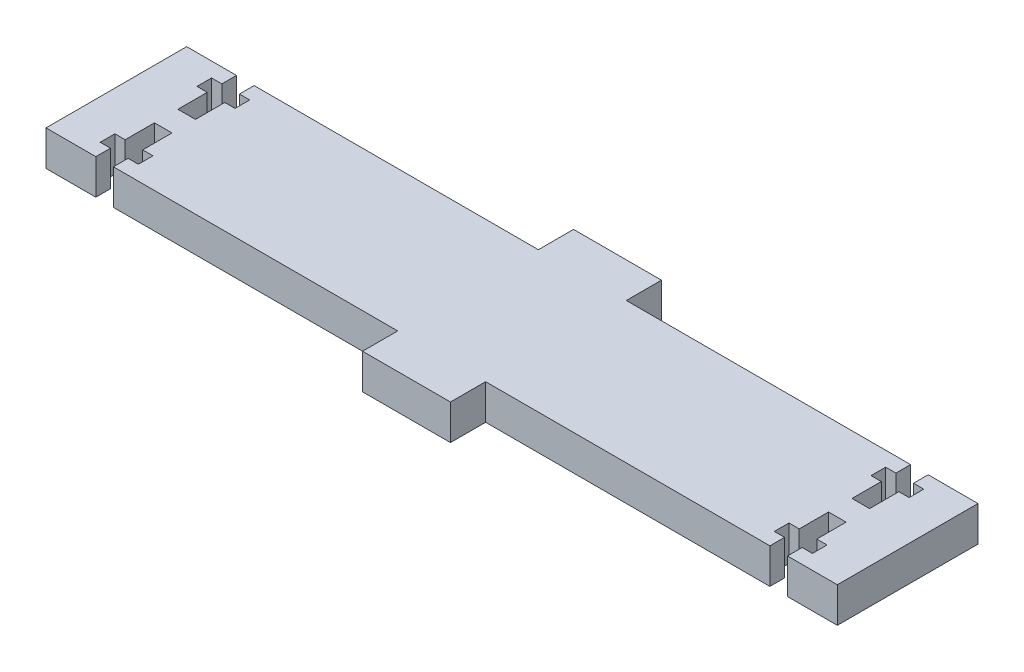
from build123d import *

# Parameters (mm, degrees)
BOSS_EXTRUDE1_DEPTH = 6


with BuildPart() as part:
    # Sketch1 → Boss-Extrude1 (new body)
    with BuildSketch(Plane(origin=(0, 0, 0), x_dir=(1, 0, 0), z_dir=(0, 1, 0))):
        Polygon((-59, 12), (-67.5, 12), (-67.5, -12), (-59, -12), (-59, -9.5), (-60.75, -9.5), (-60.75, -7), (-59, -7), (-59, -2), (-56, -2), (-56, -7), (-54.25, -7), (-54.25, -9.5), (-56, -9.5), (-56, -12), (-7.5, -12), (-7.5, -18), (7.5, -18), (7.5, -12), (56, -12), (56, -9.5), (54.25, -9.5), (54.25, -7), (56, -7), (56, -2), (59, -2), (59, -7), (60.75, -7), (60.75, -9.5), (59, -9.5), (59, -12), (67.5, -12), (67.5, 12), (59, 12), (59, 9.5), (60.75, 9.5), (60.75, 7), (59, 7), (59, 2), (56, 2), (56, 7), (54.25, 7), (54.25, 9.5), (56, 9.5), (56, 12), (7.5, 12), (7.5, 18), (-7.5, 18), (-7.5, 12), (-56, 12), (-56, 9.5), (-54.25, 9.5), (-54.25, 7), (-56, 7), (-56, 2), (-59, 2), (-59, 7), (-60.75, 7), (-60.75, 9.5), (-59, 9.5), align=None)
    extrude(amount=BOSS_EXTRUDE1_DEPTH)


solid = part.part
